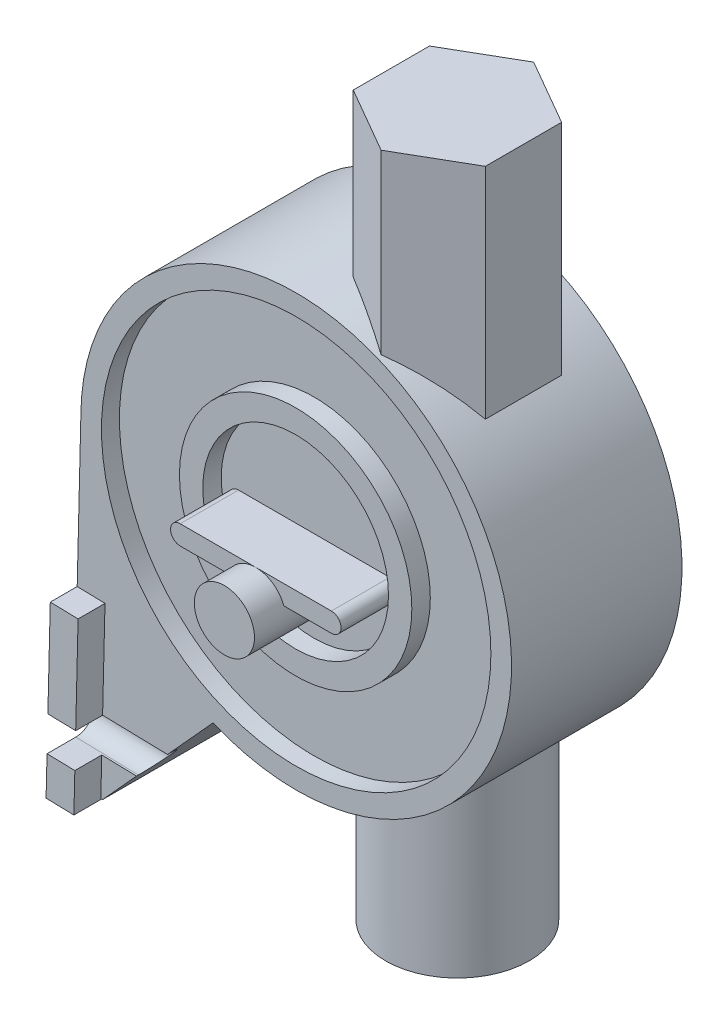
from build123d import *

# Parameters (mm, degrees)
SKETCH3_R           = 24
BOSS_EXTRUDE1_DEPTH = 19
BOSS_EXTRUDE2_DEPTH = 19
SKETCH7_R           = 8
BOSS_EXTRUDE3_DEPTH = 22.5
BOSS_EXTRUDE4_DEPTH = 26
SKETCH9_W           = 3
SKETCH9_H           = 19.17
BOSS_EXTRUDE5_DEPTH = 3.1
SKETCH10_R          = 1.68
CUT_EXTRUDE1_DEPTH  = 15
SKETCH11_R          = 21.7
CUT_EXTRUDE2_DEPTH  = 2
SKETCH12_R          = 12.95
SKETCH12_R_2        = 10.35
BOSS_EXTRUDE6_DEPTH = 2.06
SKETCH13_R          = 3.35
BOSS_EXTRUDE7_DEPTH = 10
BOSS_EXTRUDE8_DEPTH = 6.5


with BuildPart() as part:
    # Sketch3 → Boss-Extrude1 (new body)
    with BuildSketch(Plane.XY):
        with Locations((225, 142.5)):
            Circle(SKETCH3_R)
    extrude(amount=BOSS_EXTRUDE1_DEPTH)

    # Sketch5 → Boss-Extrude2 (add)
    with BuildSketch(Plane.XY):
        with BuildLine():
            Line((201, 142.5), (200.127626755, 106.785172639))
            Line((200.127626755, 106.785172639), (203.414220338, 106.785172639))
            Line((203.414220338, 106.785172639), (215.733540757, 120.361058447))
            ThreePointArc((215.733540757, 120.361058447), (205.020072299, 129.203290291), (201, 142.5))
        make_face()
    extrude(amount=BOSS_EXTRUDE2_DEPTH)

    # Sketch7 → Boss-Extrude3 (add)
    with BuildSketch(Plane(origin=(0, 128.5, 0), x_dir=(-1, 0, 0), z_dir=(0, -1, 0))):
        with Locations((-233.969805688, -10)):
            Circle(SKETCH7_R)
    extrude(amount=BOSS_EXTRUDE3_DEPTH)

    # Sketch8 → Boss-Extrude4 (add)
    with BuildSketch(Plane(origin=(0, 158.5, 0), x_dir=(-1, 0, 0), z_dir=(0, -1, 0))):
        Polygon((-241.33102162, -5.75), (-241.33102162, -14.25), (-233.969805688, -18.5), (-226.608589756, -14.25), (-226.608589756, -5.75), (-233.969805688, -1.5), align=None)
    extrude(amount=-BOSS_EXTRUDE4_DEPTH)

    # Sketch9 → Boss-Extrude5 (add)
    with BuildSketch(Plane(origin=(197.401507206, -4.821745091, 0), x_dir=(0, 0, 1), z_dir=(-0.999701816720525, 0.024418796974499463, 0))):
        with Locations((20.5, 121.225206973)):
            Rectangle(SKETCH9_W, SKETCH9_H)
    extrude(amount=-BOSS_EXTRUDE5_DEPTH)

    # Sketch10 → Cut-Extrude1 (cut)
    with BuildSketch(Plane(origin=(197.401507206, -4.821745091, 0), x_dir=(0, 0, 1), z_dir=(-0.9997018167205249, 0.02441879697449946, 0))):
        with Locations((3.14, 143.570206973)):
            Circle(SKETCH10_R)
        with BuildLine():
            Line((0, 119.880206973), (0, 115.990206973))
            Line((0, 115.990206973), (3.205, 115.990206973))
            ThreePointArc((3.205, 115.990206973), (5.15, 117.935206973), (3.205, 119.880206973))
            Line((3.205, 119.880206973), (0, 119.880206973))
        make_face()
        with BuildLine():
            Line((22, 115.990206973), (22, 119.880206973))
            Line((22, 119.880206973), (18.795, 119.880206973))
            ThreePointArc((18.795, 119.880206973), (16.85, 117.935206973), (18.795, 115.990206973))
            Line((18.795, 115.990206973), (22, 115.990206973))
        make_face()
    extrude(amount=-CUT_EXTRUDE1_DEPTH, mode=Mode.SUBTRACT)

    # Sketch11 → Cut-Extrude2 (cut)
    with BuildSketch(Plane.XY.offset(19)):
        with Locations((225, 142.5)):
            Circle(SKETCH11_R)
    extrude(amount=-CUT_EXTRUDE2_DEPTH, mode=Mode.SUBTRACT)

    # Sketch12 → Boss-Extrude6 (add)
    with BuildSketch(Plane.XY.offset(17)):
        with Locations((225, 142.5)):
            Circle(SKETCH12_R)
        with Locations((225, 142.5)):
            Circle(SKETCH12_R_2, mode=Mode.SUBTRACT)
    extrude(amount=BOSS_EXTRUDE6_DEPTH)

    # Sketch13 → Boss-Extrude7 (add)
    with BuildSketch(Plane.XY.offset(17)):
        with Locations((225, 138.9)):
            Circle(SKETCH13_R)
    extrude(amount=BOSS_EXTRUDE7_DEPTH)

    # Sketch14 → Boss-Extrude8 (add)
    with BuildSketch(Plane.XY.offset(17)):
        with BuildLine():
            Line((216.575, 142.25), (233.425, 142.25))
            ThreePointArc((233.425, 142.25), (234.5, 141.175), (233.425, 140.1))
            Line((233.425, 140.1), (216.575, 140.1))
            ThreePointArc((216.575, 140.1), (215.5, 141.175), (216.575, 142.25))
        make_face()
    extrude(amount=BOSS_EXTRUDE8_DEPTH)


solid = part.part
